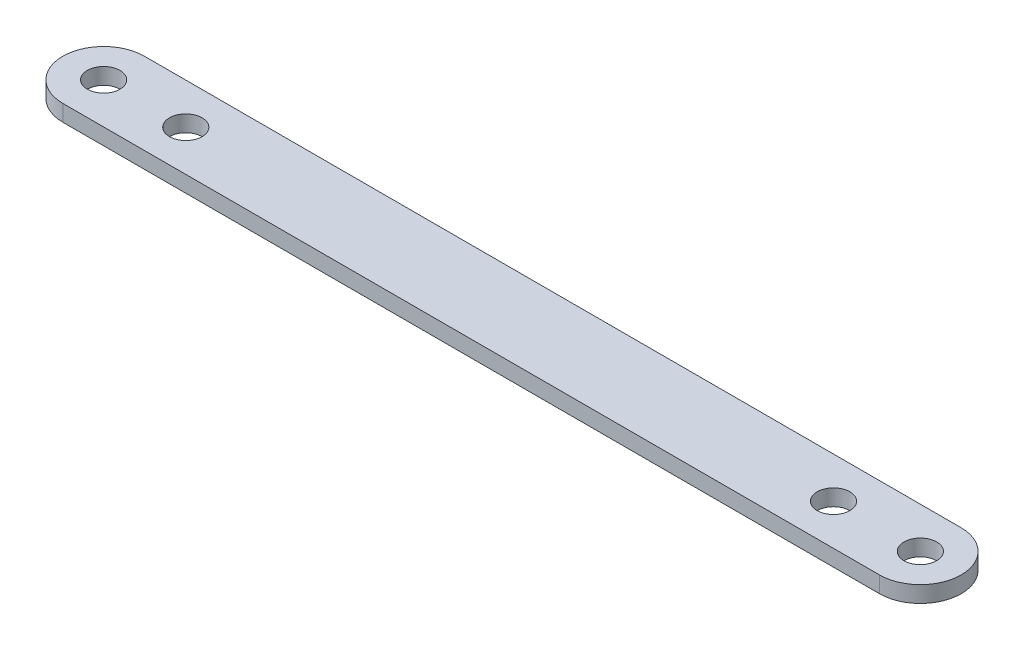
from build123d import *

# Parameters (mm, degrees)
SKETCH_1_R          = 2.3
EXTRUDE_1_DEPTH     = 2
SKETCH_2_R          = 2.445702399
SKETCH_2_R_2        = 2
EXTRUDE_2_DEPTH     = 2
SKETCH_3_R          = 2.726249273
SKETCH_3_R_2        = 2
EXTRUDE_3_DEPTH     = 2
SKETCH_4_R          = 2
CUT_EXTRUDE_1_DEPTH = 2


with BuildPart() as part:
    # 草图1 → 凸台-拉伸1 (new body)
    with BuildSketch(Plane(origin=(0, 0, 0), x_dir=(1, 0, 0), z_dir=(0, 1, 0))):
        with BuildLine():
            Line((0, 5), (100, 5))
            ThreePointArc((100, 5), (105, 0), (100, -5))
            Line((100, -5), (0, -5))
            ThreePointArc((0, -5), (-5, 0), (0, 5))
        make_face()
        with Locations(Location((0, 0, 0), (0, 0, 270))):
            Circle(SKETCH_1_R, mode=Mode.SUBTRACT)
        with Locations(Location((100, 0, 0), (0, 0, 270))):
            Circle(SKETCH_1_R, mode=Mode.SUBTRACT)
    extrude(amount=EXTRUDE_1_DEPTH)

    # 草图2 → 凸台-拉伸2 (add)
    with BuildSketch(Plane(origin=(0, 2, 0), x_dir=(1, 0, 0), z_dir=(0, 1, 0))):
        Circle(SKETCH_2_R)
        with Locations(Location((0, 0, 0), (0, 0, 270))):
            Circle(SKETCH_2_R_2, mode=Mode.SUBTRACT)
    extrude(amount=-EXTRUDE_2_DEPTH)

    # 草图3 → 凸台-拉伸3 (add)
    with BuildSketch(Plane(origin=(0, 2, 0), x_dir=(1, 0, 0), z_dir=(0, 1, 0))):
        with Locations((100, 0)):
            Circle(SKETCH_3_R)
        with Locations(Location((100, 0, 0), (0, 0, 270))):
            Circle(SKETCH_3_R_2, mode=Mode.SUBTRACT)
    extrude(amount=-EXTRUDE_3_DEPTH)

    # 草图4 → 切除-拉伸1 (cut)
    with BuildSketch(Plane(origin=(0, 2, 0), x_dir=(1, 0, 0), z_dir=(0, 1, 0))):
        with Locations(Location((10.057445081, 0, 0), (0, 0, 270))):
            Circle(SKETCH_4_R)
        with Locations(Location((89.366430164, 0, 0), (0, 0, 270))):
            Circle(SKETCH_4_R)
    extrude(amount=-CUT_EXTRUDE_1_DEPTH, mode=Mode.SUBTRACT)


solid = part.part
